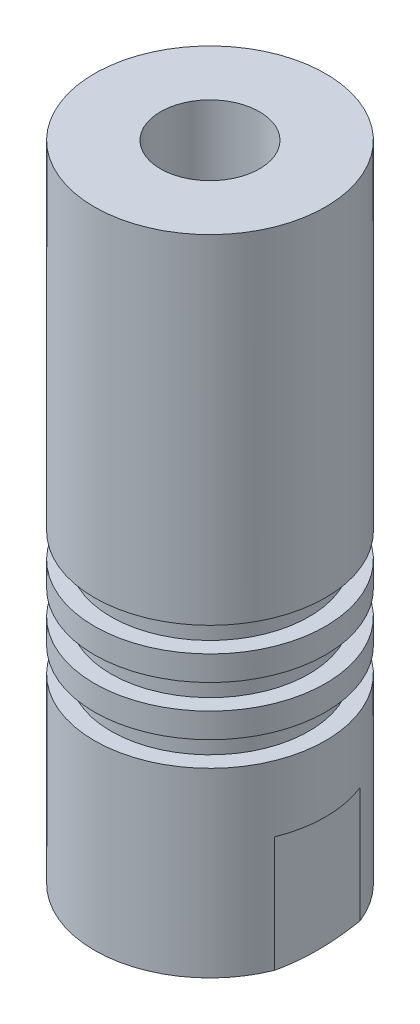
from build123d import *

# Parameters (mm, degrees)
TAGLIO_ESTRUSIONE1_REACH                  = 43.569
TAGLIO_ESTRUSIONE1_END_RADIUS             = 8
SCHIZZO2_W                                = 1.5
SCHIZZO2_H                                = 8
TAGLIO_ESTRUSIONE1_DIRECTION_2_REACH      = 43.569
TAGLIO_ESTRUSIONE1_DIRECTION_2_END_RADIUS = 8
SCHIZZO7_R                                = 3
TAGLIO_ESTRUSIONE2_DEPTH                  = 42.569219382
FORO_FILETTATO_M8_1_D                     = 6.8
FORO_FILETTATO_M8_1_DEPTH                 = 12
FORO_FILETTATO_M8_1_TIP                   = 2.042926105
TAGLIO_ESTRUSIONE3_REACH                  = 43.569
SCHIZZO10_R                               = 8
SCHIZZO10_R_2                             = 7
ESTRUSIONE_ESTRUSIONE1_START              = 4.6
SCHIZZO11_R                               = 7
ESTRUSIONE_ESTRUSIONE1_DEPTH              = 4.6
SCHIZZO12_R                               = 3
TAGLIO_ESTRUSIONE4_DEPTH                  = 5


with BuildPart() as part:
    # Schizzo1 → Rivoluzione1 (revolve)
    with BuildSketch(Plane.XY, mode=Mode.PRIVATE) as rivoluzione1_sk:
        Polygon((0, 0), (-5, 0), (-8, 1.5), (-8, 12), (-6, 12), (-6, 13.5), (-8, 13.5), (-8, 15), (-6, 15), (-6, 16.5), (-8, 16.5), (-8, 18), (-6, 18), (-6, 19.5), (-8, 19.5), (-8, 30.6), (-6, 30.6), (-6, 35.2), (-8, 35.2), (-8, 40), (0, 40), align=None)
    revolve(rivoluzione1_sk.sketch.rotate(Axis((0, 129.407380346, 0), (0, -1, 0)), 270), axis=Axis((0, 129.407380346, 0), (0, -1, 0)))

    # Taglio-Estrusione1: up to this cylinder (the profile starts inside it)
    taglio_estrusione1_end = Plane(origin=(0, 4, 0), z_dir=(0, 1, 0)) * Cylinder(TAGLIO_ESTRUSIONE1_END_RADIUS, 104.138, mode=Mode.PRIVATE)
    # Schizzo2 → Taglio-Estrusione1 (cut, up to the surface)
    with BuildSketch(Plane.XY, mode=Mode.PRIVATE) as taglio_estrusione1_sk1:
        with Locations((-7.25, 4)):
            Rectangle(SCHIZZO2_W, SCHIZZO2_H)
    taglio_estrusione1_tool1 = extrude(taglio_estrusione1_sk1.sketch, amount=-TAGLIO_ESTRUSIONE1_REACH, mode=Mode.PRIVATE) & taglio_estrusione1_end
    add(taglio_estrusione1_tool1.solids().sort_by_distance((-7.25, 4, 0))[0], mode=Mode.SUBTRACT)
    # Schizzo2 → Taglio-Estrusione1 (cut, up to the surface)
    with BuildSketch(Plane.XY, mode=Mode.PRIVATE) as taglio_estrusione1_sk2:
        with Locations((7.25, 4)):
            Rectangle(SCHIZZO2_W, SCHIZZO2_H)
    taglio_estrusione1_tool2 = extrude(taglio_estrusione1_sk2.sketch, amount=-TAGLIO_ESTRUSIONE1_REACH, mode=Mode.PRIVATE) & taglio_estrusione1_end
    add(taglio_estrusione1_tool2.solids().sort_by_distance((7.25, 4, 0))[0], mode=Mode.SUBTRACT)

    # Taglio-Estrusione1 direction 2: up to this cylinder (the profile starts inside it)
    taglio_estrusione1_direction_2_end = Plane(origin=(0, 4, 0), z_dir=(0, 1, 0)) * Cylinder(TAGLIO_ESTRUSIONE1_DIRECTION_2_END_RADIUS, 104.138, mode=Mode.PRIVATE)
    # Schizzo2 → Taglio-Estrusione1 direction 2 (cut, up to the surface)
    with BuildSketch(Plane.XY, mode=Mode.PRIVATE) as taglio_estrusione1_direction_2_sk1:
        with Locations((-7.25, 4)):
            Rectangle(SCHIZZO2_W, SCHIZZO2_H)
    taglio_estrusione1_direction_2_tool1 = extrude(taglio_estrusione1_direction_2_sk1.sketch, amount=TAGLIO_ESTRUSIONE1_DIRECTION_2_REACH, mode=Mode.PRIVATE) & taglio_estrusione1_direction_2_end
    add(taglio_estrusione1_direction_2_tool1.solids().sort_by_distance((-7.25, 4, 0))[0], mode=Mode.SUBTRACT)
    # Schizzo2 → Taglio-Estrusione1 direction 2 (cut, up to the surface)
    with BuildSketch(Plane.XY, mode=Mode.PRIVATE) as taglio_estrusione1_direction_2_sk2:
        with Locations((7.25, 4)):
            Rectangle(SCHIZZO2_W, SCHIZZO2_H)
    taglio_estrusione1_direction_2_tool2 = extrude(taglio_estrusione1_direction_2_sk2.sketch, amount=TAGLIO_ESTRUSIONE1_DIRECTION_2_REACH, mode=Mode.PRIVATE) & taglio_estrusione1_direction_2_end
    add(taglio_estrusione1_direction_2_tool2.solids().sort_by_distance((7.25, 4, 0))[0], mode=Mode.SUBTRACT)

    # Schizzo7 → Taglio-Estrusione2 (cut, through all)
    with BuildSketch(Plane(origin=(0, 40, 0), x_dir=(1, 0, 0), z_dir=(0, 1, 0))):
        with Locations(Location((0, 0, 0), (0, 0, 270))):
            Circle(SCHIZZO7_R)
    extrude(amount=-TAGLIO_ESTRUSIONE2_DEPTH, mode=Mode.SUBTRACT)

    # Foro filettato M8-1
    with Locations(Plane(origin=(0, 0, 0), x_dir=(-1, 0, 0), z_dir=(0, -1, 0))):
        with Locations((0, 0)):
            Hole(FORO_FILETTATO_M8_1_D / 2, depth=FORO_FILETTATO_M8_1_DEPTH)
            with Locations((0, 0, -(FORO_FILETTATO_M8_1_DEPTH + FORO_FILETTATO_M8_1_TIP / 2))):  # 118° drill point
                Cone(0, FORO_FILETTATO_M8_1_D / 2, FORO_FILETTATO_M8_1_TIP, mode=Mode.SUBTRACT)

    # Taglio-Estrusione3: up to this face of the body (flat: up to its plane)
    taglio_estrusione3_end = Plane(part.part.faces().sort_by_distance((0, 0, -4.858578644))[0])
    # Schizzo10 → Taglio-Estrusione3 (cut, up to the picked face)
    with BuildSketch(Plane(origin=(0, 40, 0), x_dir=(1, 0, 0), z_dir=(0, 1, 0)), mode=Mode.PRIVATE) as taglio_estrusione3_sk1:
        Circle(SCHIZZO10_R)
        with Locations(Location((0, 0, 0), (0, 0, 270))):
            Circle(SCHIZZO10_R_2, mode=Mode.SUBTRACT)
    taglio_estrusione3_tool1 = split(extrude(taglio_estrusione3_sk1.sketch, amount=-TAGLIO_ESTRUSIONE3_REACH, mode=Mode.PRIVATE), bisect_by=taglio_estrusione3_end, keep=Keep.BOTH, mode=Mode.PRIVATE)
    add(taglio_estrusione3_tool1.solids().sort_by(Axis((-7.773726, 40, 0), (0, -1, 0)))[0], mode=Mode.SUBTRACT)

    # Schizzo11 → Estrusione-Estrusione1 (add)
    with BuildSketch(Plane(origin=(0, 30.6, 0), x_dir=(1, 0, 0), z_dir=(0, 1, 0)).offset(ESTRUSIONE_ESTRUSIONE1_START)):
        with Locations(Location((0, 0, 0), (0, 0, 270))):
            Circle(SCHIZZO11_R)
    extrude(amount=-ESTRUSIONE_ESTRUSIONE1_DEPTH)

    # Schizzo12 → Taglio-Estrusione4 (cut)
    with BuildSketch(Plane(origin=(0, 35.2, 0), x_dir=(1, 0, 0), z_dir=(0, 1, 0))):
        with Locations(Location((0, 0, 0), (0, 0, 270))):
            Circle(SCHIZZO12_R)
    extrude(amount=-TAGLIO_ESTRUSIONE4_DEPTH, mode=Mode.SUBTRACT)


solid = part.part
